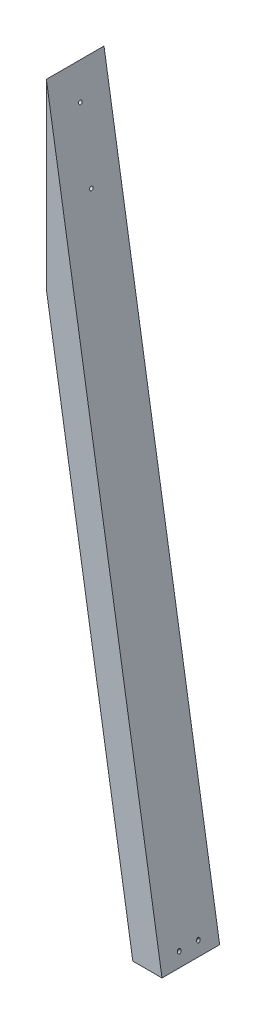
from build123d import *

# Parameters (mm, degrees)
BOSS_EXTRUDE1_DEPTH     = 101.6
SKETCH2_R               = 3.175
CUT_EXTRUDE1_DEPTH      = 930.148
CUT_EXTRUDE2_DEPTH      = 129.032
CUT_EXTRUDE2_DEPTH_BACK = 167.132
SKETCH3_R               = 3.175


with BuildPart() as part:
    # Sketch1 → Boss-Extrude1 (new body)
    with BuildSketch(Plane.XY):
        Polygon((0, 949.461691672), (0, 1270), (203.850246616, 0), (152.4, 0), align=None)
    extrude(amount=BOSS_EXTRUDE1_DEPTH)

    # Sketch2 → Cut-Extrude1 (cut)
    with BuildSketch(Plane.ZY):
        with Locations(Location((50.8, 1213.824708718, 0), (0, 0, 270))):
            Circle(SKETCH2_R)
        with Locations(Location((50.8, 1092.198474258, 0), (0, 0, 270))):
            Circle(SKETCH2_R)
    extrude(amount=-CUT_EXTRUDE1_DEPTH, mode=Mode.SUBTRACT)

    # Sketch3 → Cut-Extrude2 (cut, two sides: drawn at the far end of the back side and taken through both)
    with BuildSketch(Plane(origin=(101.925123308, 101.925123308, 0), x_dir=(0, 0, -1), z_dir=(-0.7071067811865487, -0.7071067811865465, 0)).offset(-CUT_EXTRUDE2_DEPTH_BACK)):
        with Locations(Location((-67.733333333, 125.953482591, 0), (0, 0, 270))):
            Circle(SKETCH3_R)
        with Locations(Location((-33.866666667, 125.953482591, 0), (0, 0, 270))):
            Circle(SKETCH3_R)
    extrude(amount=CUT_EXTRUDE2_DEPTH + CUT_EXTRUDE2_DEPTH_BACK, mode=Mode.SUBTRACT)


solid = part.part
